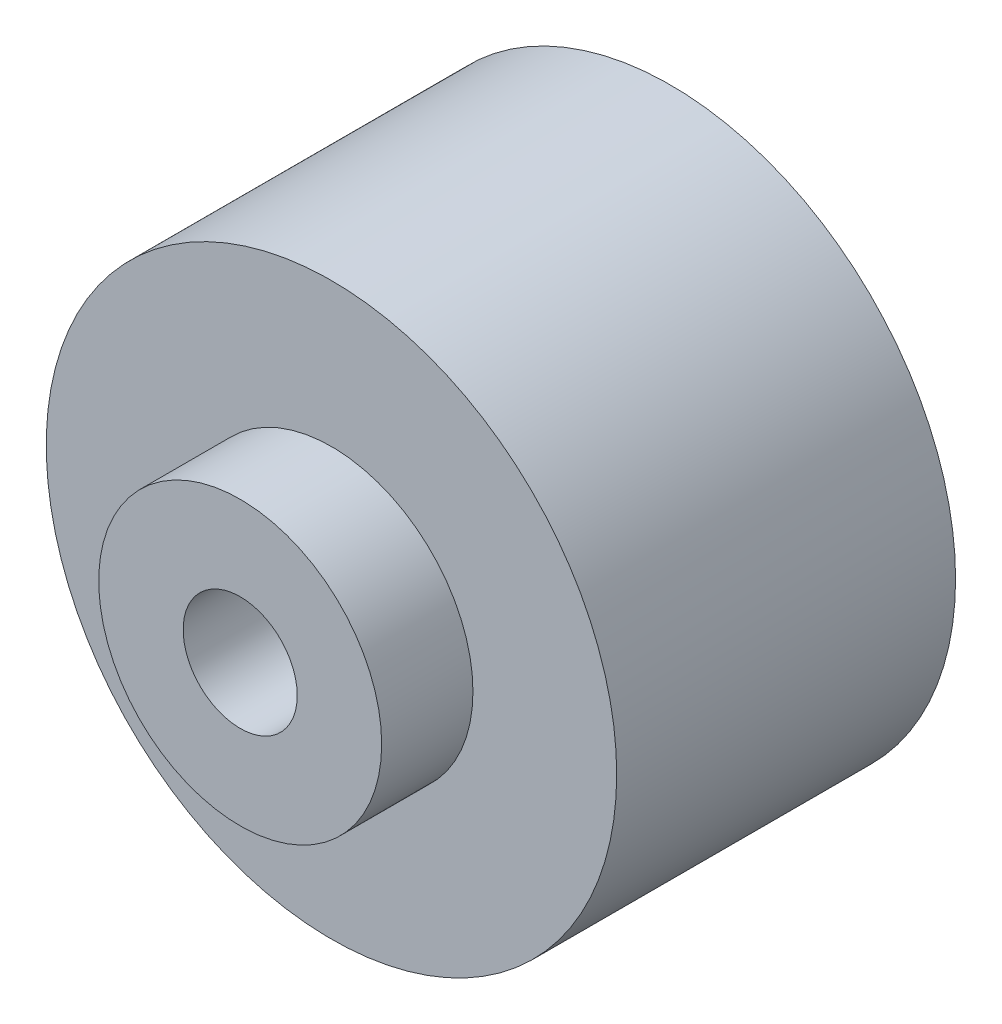
from build123d import *

# Parameters (mm, degrees)
IZIM1_R                     = 25
Y_KSEKLIK_EKSTR_ZYON1_DEPTH = 29.7
IZIM2_R                     = 11
Y_KSEKLIK_EKSTR_ZYON2_DEPTH = 6
IZIM3_R                     = 12.4
Y_KSEKLIK_EKSTR_ZYON3_DEPTH = 8
IZIM4_R                     = 5
KES_EKSTR_ZYON1_DEPTH       = 57.211119896


with BuildPart() as part:
    # Çizim1 → Yükseklik-Ekstrüzyon1 (new body)
    with BuildSketch(Plane.XY):
        Circle(IZIM1_R)
    extrude(amount=Y_KSEKLIK_EKSTR_ZYON1_DEPTH)

    # Çizim2 → Yükseklik-Ekstrüzyon2 (add)
    with BuildSketch(Plane(origin=(0, 0, 0), x_dir=(-1, 0, 0), z_dir=(0, 0, -1))):
        Circle(IZIM2_R)
    extrude(amount=Y_KSEKLIK_EKSTR_ZYON2_DEPTH)

    # Çizim3 → Yükseklik-Ekstrüzyon3 (add)
    with BuildSketch(Plane.XY.offset(29.7)):
        Circle(IZIM3_R)
    extrude(amount=Y_KSEKLIK_EKSTR_ZYON3_DEPTH)

    # Çizim4 → Kes-Ekstrüzyon1 (cut, through all)
    with BuildSketch(Plane.XY.offset(37.7)):
        Circle(IZIM4_R)
    extrude(amount=-KES_EKSTR_ZYON1_DEPTH, mode=Mode.SUBTRACT)


solid = part.part
